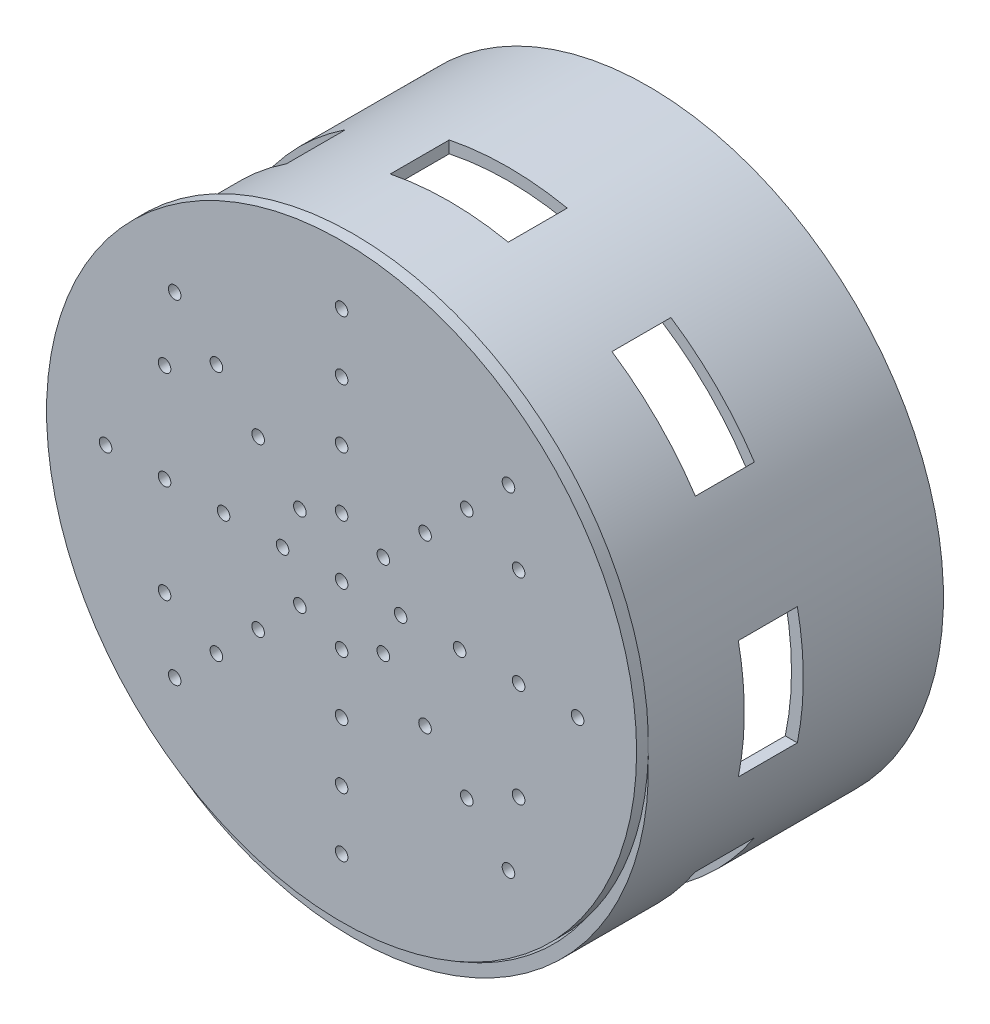
from build123d import *

# Parameters (mm, degrees)
SKETCH1_R                    = 75
SKETCH1_R_2                  = 1.6
BOSS_EXTRUDE1_DEPTH          = 3
SKETCH2_R                    = 75
SKETCH2_R_2                  = 72
BOSS_EXTRUDE2_DEPTH          = 75
SKETCH3_W                    = 30
SKETCH3_H                    = 15
CUT_EXTRUDE1_DEPTH           = 14
CIRPATTERN1_COUNT            = 8
SKETCH4_R                    = 1.6
CUT_EXTRUDE2_DEPTH           = 3
LPATTERN2_COUNT              = 5
LPATTERN2_PITCH              = 15
CIRPATTERN2_COPY_1_SKETCH_R  = 1.6
CIRPATTERN2_COPY_1_DEPTH     = 3
CIRPATTERN2_COPY_2_SKETCH_R  = 1.6
CIRPATTERN2_COPY_2_DEPTH     = 3
CIRPATTERN2_COPY_3_SKETCH_R  = 1.6
CIRPATTERN2_COPY_3_DEPTH     = 3
CIRPATTERN2_COPY_4_SKETCH_R  = 1.6
CIRPATTERN2_COPY_4_DEPTH     = 3
CIRPATTERN2_COPY_5_SKETCH_R  = 1.6
CIRPATTERN2_COPY_5_DEPTH     = 3
CIRPATTERN2_COPY_6_SKETCH_R  = 1.6
CIRPATTERN2_COPY_6_DEPTH     = 3
CIRPATTERN2_COPY_7_SKETCH_R  = 1.6
CIRPATTERN2_COPY_7_DEPTH     = 3
CIRPATTERN2_COPY_8_SKETCH_R  = 1.6
CIRPATTERN2_COPY_8_DEPTH     = 3
CIRPATTERN2_COPY_9_SKETCH_R  = 1.6
CIRPATTERN2_COPY_9_DEPTH     = 3
CIRPATTERN2_COPY_10_SKETCH_R = 1.6
CIRPATTERN2_COPY_10_DEPTH    = 3
CIRPATTERN2_COPY_11_SKETCH_R = 1.6
CIRPATTERN2_COPY_11_DEPTH    = 3
CIRPATTERN2_COPY_12_SKETCH_R = 1.6
CIRPATTERN2_COPY_12_DEPTH    = 3
CIRPATTERN2_COPY_13_SKETCH_R = 1.6
CIRPATTERN2_COPY_13_DEPTH    = 3
CIRPATTERN2_COPY_14_SKETCH_R = 1.6
CIRPATTERN2_COPY_14_DEPTH    = 3
CIRPATTERN2_COPY_15_SKETCH_R = 1.6
CIRPATTERN2_COPY_15_DEPTH    = 3
CIRPATTERN2_COPY_16_SKETCH_R = 1.6
CIRPATTERN2_COPY_16_DEPTH    = 3
CIRPATTERN2_COPY_17_SKETCH_R = 1.6
CIRPATTERN2_COPY_17_DEPTH    = 3
CIRPATTERN2_COPY_18_SKETCH_R = 1.6
CIRPATTERN2_COPY_18_DEPTH    = 3
CIRPATTERN2_COPY_19_SKETCH_R = 1.6
CIRPATTERN2_COPY_19_DEPTH    = 3
CIRPATTERN2_COPY_20_SKETCH_R = 1.6
CIRPATTERN2_COPY_20_DEPTH    = 3
CIRPATTERN2_COPY_21_SKETCH_R = 1.6
CIRPATTERN2_COPY_21_DEPTH    = 3
CIRPATTERN2_COPY_22_SKETCH_R = 1.6
CIRPATTERN2_COPY_22_DEPTH    = 3
CIRPATTERN2_COPY_23_SKETCH_R = 1.6
CIRPATTERN2_COPY_23_DEPTH    = 3
CIRPATTERN2_COPY_24_SKETCH_R = 1.6
CIRPATTERN2_COPY_24_DEPTH    = 3
CIRPATTERN2_COPY_25_SKETCH_R = 1.6
CIRPATTERN2_COPY_25_DEPTH    = 3
CIRPATTERN2_COPY_26_SKETCH_R = 1.6
CIRPATTERN2_COPY_26_DEPTH    = 3
CIRPATTERN2_COPY_27_SKETCH_R = 1.6
CIRPATTERN2_COPY_27_DEPTH    = 3
CIRPATTERN2_COPY_28_SKETCH_R = 1.6
CIRPATTERN2_COPY_28_DEPTH    = 3
CIRPATTERN2_COPY_29_SKETCH_R = 1.6
CIRPATTERN2_COPY_29_DEPTH    = 3
CIRPATTERN2_COPY_30_SKETCH_R = 1.6
CIRPATTERN2_COPY_30_DEPTH    = 3
CIRPATTERN2_COPY_31_SKETCH_R = 1.6
CIRPATTERN2_COPY_31_DEPTH    = 3
CIRPATTERN2_COPY_32_SKETCH_R = 1.6
CIRPATTERN2_COPY_32_DEPTH    = 3
CIRPATTERN2_COPY_33_SKETCH_R = 1.6
CIRPATTERN2_COPY_33_DEPTH    = 3
CIRPATTERN2_COPY_34_SKETCH_R = 1.6
CIRPATTERN2_COPY_34_DEPTH    = 3
CIRPATTERN2_COPY_35_SKETCH_R = 1.6
CIRPATTERN2_COPY_35_DEPTH    = 3


with BuildPart() as part:
    # Sketch1 → Boss-Extrude1 (new body)
    with BuildSketch(Plane.XY):
        with Locations((56.033557165, -98.835370465)):
            Circle(SKETCH1_R)
        with Locations((11.033557165, -73.835370465)):
            Circle(SKETCH1_R_2, mode=Mode.SUBTRACT)
        with Locations((101.033557165, -73.835370465)):
            Circle(SKETCH1_R_2, mode=Mode.SUBTRACT)
        with Locations((11.033557165, -123.835370465)):
            Circle(SKETCH1_R_2, mode=Mode.SUBTRACT)
        with Locations((101.033557165, -123.835370465)):
            Circle(SKETCH1_R_2, mode=Mode.SUBTRACT)
    extrude(amount=BOSS_EXTRUDE1_DEPTH)

    # Sketch2 → Boss-Extrude2 (add)
    with BuildSketch(Plane(origin=(0, 0, 0), x_dir=(-1, 0, 0), z_dir=(0, 0, -1))):
        with Locations(Location((-56.033557165, -103.835370465, 0), (0, 0, 178.089786828))):
            Circle(SKETCH2_R)
        with Locations(Location((-56.033557165, -103.835370465, 0), (0, 0, 215.294394677))):
            Circle(SKETCH2_R_2, mode=Mode.SUBTRACT)
    extrude(amount=BOSS_EXTRUDE2_DEPTH)

    # Sketch3 → Cut-Extrude1 (cut)
    with BuildSketch(Plane(origin=(0, -23.835370465, 0), x_dir=(1, 0, 0), z_dir=(0, 1, 0))):
        with Locations((56.033557165, 31.87)):
            Rectangle(SKETCH3_W, SKETCH3_H)
    cut_extrude1 = extrude(amount=-CUT_EXTRUDE1_DEPTH, mode=Mode.SUBTRACT)

    # CirPattern1: Cut-Extrude1 ×8 about axis
    cirpattern1_axis = Axis((56.033557165, -103.835370465, 0), (0, 0, 1))
    for i in range(1, CIRPATTERN1_COUNT):
        add(cut_extrude1.rotate(cirpattern1_axis, i * 360 / CIRPATTERN1_COUNT), mode=Mode.SUBTRACT)

    # Sketch4 → Cut-Extrude2 (cut)
    with BuildSketch(Plane.XY.offset(3)):
        with Locations((56.033557165, -98.835370465)):
            Circle(SKETCH4_R)
    cut_extrude2 = extrude(amount=-CUT_EXTRUDE2_DEPTH, mode=Mode.SUBTRACT)

    # LPattern2: Cut-Extrude2 ×5
    with Locations(*[(0, i * LPATTERN2_PITCH, 0) for i in range(1, LPATTERN2_COUNT)]):
        add(cut_extrude2, mode=Mode.SUBTRACT)

    # CirPattern2 copy 1 sketch → CirPattern2 copy 1 (cut)
    with BuildSketch(Plane(origin=(-64.081913475, -57.963316316, 3), x_dir=(0.7071067811865476, 0.7071067811865475, 0), z_dir=(0, 0, 1))):
        with Locations((56.033557165, -98.835370465)):
            Circle(CIRPATTERN2_COPY_1_SKETCH_R)
    extrude(amount=-CIRPATTERN2_COPY_1_DEPTH, mode=Mode.SUBTRACT)

    # CirPattern2 copy 2 sketch → CirPattern2 copy 2 (cut)
    with BuildSketch(Plane(origin=(-57.8018133, -154.86892763, 3), x_dir=(0, 1, 0), z_dir=(0, 0, 1))):
        with Locations((56.033557165, -98.835370465)):
            Circle(CIRPATTERN2_COPY_2_SKETCH_R)
    extrude(amount=-CIRPATTERN2_COPY_2_DEPTH, mode=Mode.SUBTRACT)

    # CirPattern2 copy 3 sketch → CirPattern2 copy 3 (cut)
    with BuildSketch(Plane(origin=(15.161503016, -218.950841105, 3), x_dir=(-0.7071067811865475, 0.7071067811865476, 0), z_dir=(0, 0, 1))):
        with Locations((56.033557165, -98.835370465)):
            Circle(CIRPATTERN2_COPY_3_SKETCH_R)
    extrude(amount=-CIRPATTERN2_COPY_3_DEPTH, mode=Mode.SUBTRACT)

    # CirPattern2 copy 4 sketch → CirPattern2 copy 4 (cut)
    with BuildSketch(Plane(origin=(112.06711433, -212.670740929, 3), x_dir=(-1, 0, 0), z_dir=(0, 0, 1))):
        with Locations((56.033557165, -98.835370465)):
            Circle(CIRPATTERN2_COPY_4_SKETCH_R)
    extrude(amount=-CIRPATTERN2_COPY_4_DEPTH, mode=Mode.SUBTRACT)

    # CirPattern2 copy 5 sketch → CirPattern2 copy 5 (cut)
    with BuildSketch(Plane(origin=(176.149027805, -139.707424614, 3), x_dir=(-0.7071067811865477, -0.7071067811865475, 0), z_dir=(0, 0, 1))):
        with Locations((56.033557165, -98.835370465)):
            Circle(CIRPATTERN2_COPY_5_SKETCH_R)
    extrude(amount=-CIRPATTERN2_COPY_5_DEPTH, mode=Mode.SUBTRACT)

    # CirPattern2 copy 6 sketch → CirPattern2 copy 6 (cut)
    with BuildSketch(Plane(origin=(169.86892763, -42.8018133, 3), x_dir=(0, -1, 0), z_dir=(0, 0, 1))):
        with Locations((56.033557165, -98.835370465)):
            Circle(CIRPATTERN2_COPY_6_SKETCH_R)
    extrude(amount=-CIRPATTERN2_COPY_6_DEPTH, mode=Mode.SUBTRACT)

    # CirPattern2 copy 7 sketch → CirPattern2 copy 7 (cut)
    with BuildSketch(Plane(origin=(96.905611314, 21.280100175, 3), x_dir=(0.7071067811865474, -0.7071067811865477, 0), z_dir=(0, 0, 1))):
        with Locations((56.033557165, -98.835370465)):
            Circle(CIRPATTERN2_COPY_7_SKETCH_R)
    extrude(amount=-CIRPATTERN2_COPY_7_DEPTH, mode=Mode.SUBTRACT)

    # CirPattern2 copy 8 sketch → CirPattern2 copy 8 (cut)
    with BuildSketch(Plane(origin=(-74.688515193, -47.356714598, 3), x_dir=(0.7071067811865476, 0.7071067811865475, 0), z_dir=(0, 0, 1))):
        with Locations((56.033557165, -98.835370465)):
            Circle(CIRPATTERN2_COPY_8_SKETCH_R)
    extrude(amount=-CIRPATTERN2_COPY_8_DEPTH, mode=Mode.SUBTRACT)

    # CirPattern2 copy 9 sketch → CirPattern2 copy 9 (cut)
    with BuildSketch(Plane(origin=(-72.8018133, -154.86892763, 3), x_dir=(0, 1, 0), z_dir=(0, 0, 1))):
        with Locations((56.033557165, -98.835370465)):
            Circle(CIRPATTERN2_COPY_9_SKETCH_R)
    extrude(amount=-CIRPATTERN2_COPY_9_DEPTH, mode=Mode.SUBTRACT)

    # CirPattern2 copy 10 sketch → CirPattern2 copy 10 (cut)
    with BuildSketch(Plane(origin=(4.554901298, -229.557442822, 3), x_dir=(-0.7071067811865475, 0.7071067811865476, 0), z_dir=(0, 0, 1))):
        with Locations((56.033557165, -98.835370465)):
            Circle(CIRPATTERN2_COPY_10_SKETCH_R)
    extrude(amount=-CIRPATTERN2_COPY_10_DEPTH, mode=Mode.SUBTRACT)

    # CirPattern2 copy 11 sketch → CirPattern2 copy 11 (cut)
    with BuildSketch(Plane(origin=(112.06711433, -227.670740929, 3), x_dir=(-1, 0, 0), z_dir=(0, 0, 1))):
        with Locations((56.033557165, -98.835370465)):
            Circle(CIRPATTERN2_COPY_11_SKETCH_R)
    extrude(amount=-CIRPATTERN2_COPY_11_DEPTH, mode=Mode.SUBTRACT)

    # CirPattern2 copy 12 sketch → CirPattern2 copy 12 (cut)
    with BuildSketch(Plane(origin=(186.755629523, -150.314026332, 3), x_dir=(-0.7071067811865477, -0.7071067811865475, 0), z_dir=(0, 0, 1))):
        with Locations((56.033557165, -98.835370465)):
            Circle(CIRPATTERN2_COPY_12_SKETCH_R)
    extrude(amount=-CIRPATTERN2_COPY_12_DEPTH, mode=Mode.SUBTRACT)

    # CirPattern2 copy 13 sketch → CirPattern2 copy 13 (cut)
    with BuildSketch(Plane(origin=(184.86892763, -42.8018133, 3), x_dir=(0, -1, 0), z_dir=(0, 0, 1))):
        with Locations((56.033557165, -98.835370465)):
            Circle(CIRPATTERN2_COPY_13_SKETCH_R)
    extrude(amount=-CIRPATTERN2_COPY_13_DEPTH, mode=Mode.SUBTRACT)

    # CirPattern2 copy 14 sketch → CirPattern2 copy 14 (cut)
    with BuildSketch(Plane(origin=(107.512213032, 31.886701893, 3), x_dir=(0.7071067811865474, -0.7071067811865477, 0), z_dir=(0, 0, 1))):
        with Locations((56.033557165, -98.835370465)):
            Circle(CIRPATTERN2_COPY_14_SKETCH_R)
    extrude(amount=-CIRPATTERN2_COPY_14_DEPTH, mode=Mode.SUBTRACT)

    # CirPattern2 copy 15 sketch → CirPattern2 copy 15 (cut)
    with BuildSketch(Plane(origin=(-85.29511691, -36.75011288, 3), x_dir=(0.7071067811865476, 0.7071067811865475, 0), z_dir=(0, 0, 1))):
        with Locations((56.033557165, -98.835370465)):
            Circle(CIRPATTERN2_COPY_15_SKETCH_R)
    extrude(amount=-CIRPATTERN2_COPY_15_DEPTH, mode=Mode.SUBTRACT)

    # CirPattern2 copy 16 sketch → CirPattern2 copy 16 (cut)
    with BuildSketch(Plane(origin=(-87.8018133, -154.86892763, 3), x_dir=(0, 1, 0), z_dir=(0, 0, 1))):
        with Locations((56.033557165, -98.835370465)):
            Circle(CIRPATTERN2_COPY_16_SKETCH_R)
    extrude(amount=-CIRPATTERN2_COPY_16_DEPTH, mode=Mode.SUBTRACT)

    # CirPattern2 copy 17 sketch → CirPattern2 copy 17 (cut)
    with BuildSketch(Plane(origin=(-6.05170042, -240.16404454, 3), x_dir=(-0.7071067811865475, 0.7071067811865476, 0), z_dir=(0, 0, 1))):
        with Locations((56.033557165, -98.835370465)):
            Circle(CIRPATTERN2_COPY_17_SKETCH_R)
    extrude(amount=-CIRPATTERN2_COPY_17_DEPTH, mode=Mode.SUBTRACT)

    # CirPattern2 copy 18 sketch → CirPattern2 copy 18 (cut)
    with BuildSketch(Plane(origin=(112.06711433, -242.670740929, 3), x_dir=(-1, 0, 0), z_dir=(0, 0, 1))):
        with Locations((56.033557165, -98.835370465)):
            Circle(CIRPATTERN2_COPY_18_SKETCH_R)
    extrude(amount=-CIRPATTERN2_COPY_18_DEPTH, mode=Mode.SUBTRACT)

    # CirPattern2 copy 19 sketch → CirPattern2 copy 19 (cut)
    with BuildSketch(Plane(origin=(197.36223124, -160.920628049, 3), x_dir=(-0.7071067811865477, -0.7071067811865475, 0), z_dir=(0, 0, 1))):
        with Locations((56.033557165, -98.835370465)):
            Circle(CIRPATTERN2_COPY_19_SKETCH_R)
    extrude(amount=-CIRPATTERN2_COPY_19_DEPTH, mode=Mode.SUBTRACT)

    # CirPattern2 copy 20 sketch → CirPattern2 copy 20 (cut)
    with BuildSketch(Plane(origin=(199.86892763, -42.8018133, 3), x_dir=(0, -1, 0), z_dir=(0, 0, 1))):
        with Locations((56.033557165, -98.835370465)):
            Circle(CIRPATTERN2_COPY_20_SKETCH_R)
    extrude(amount=-CIRPATTERN2_COPY_20_DEPTH, mode=Mode.SUBTRACT)

    # CirPattern2 copy 21 sketch → CirPattern2 copy 21 (cut)
    with BuildSketch(Plane(origin=(118.11881475, 42.493303611, 3), x_dir=(0.7071067811865474, -0.7071067811865477, 0), z_dir=(0, 0, 1))):
        with Locations((56.033557165, -98.835370465)):
            Circle(CIRPATTERN2_COPY_21_SKETCH_R)
    extrude(amount=-CIRPATTERN2_COPY_21_DEPTH, mode=Mode.SUBTRACT)

    # CirPattern2 copy 22 sketch → CirPattern2 copy 22 (cut)
    with BuildSketch(Plane(origin=(-95.901718628, -26.143511162, 3), x_dir=(0.7071067811865476, 0.7071067811865475, 0), z_dir=(0, 0, 1))):
        with Locations((56.033557165, -98.835370465)):
            Circle(CIRPATTERN2_COPY_22_SKETCH_R)
    extrude(amount=-CIRPATTERN2_COPY_22_DEPTH, mode=Mode.SUBTRACT)

    # CirPattern2 copy 23 sketch → CirPattern2 copy 23 (cut)
    with BuildSketch(Plane(origin=(-102.8018133, -154.86892763, 3), x_dir=(0, 1, 0), z_dir=(0, 0, 1))):
        with Locations((56.033557165, -98.835370465)):
            Circle(CIRPATTERN2_COPY_23_SKETCH_R)
    extrude(amount=-CIRPATTERN2_COPY_23_DEPTH, mode=Mode.SUBTRACT)

    # CirPattern2 copy 24 sketch → CirPattern2 copy 24 (cut)
    with BuildSketch(Plane(origin=(-16.658302138, -250.770646258, 3), x_dir=(-0.7071067811865475, 0.7071067811865476, 0), z_dir=(0, 0, 1))):
        with Locations((56.033557165, -98.835370465)):
            Circle(CIRPATTERN2_COPY_24_SKETCH_R)
    extrude(amount=-CIRPATTERN2_COPY_24_DEPTH, mode=Mode.SUBTRACT)

    # CirPattern2 copy 25 sketch → CirPattern2 copy 25 (cut)
    with BuildSketch(Plane(origin=(112.06711433, -257.670740929, 3), x_dir=(-1, 0, 0), z_dir=(0, 0, 1))):
        with Locations((56.033557165, -98.835370465)):
            Circle(CIRPATTERN2_COPY_25_SKETCH_R)
    extrude(amount=-CIRPATTERN2_COPY_25_DEPTH, mode=Mode.SUBTRACT)

    # CirPattern2 copy 26 sketch → CirPattern2 copy 26 (cut)
    with BuildSketch(Plane(origin=(207.968832958, -171.527229767, 3), x_dir=(-0.7071067811865477, -0.7071067811865475, 0), z_dir=(0, 0, 1))):
        with Locations((56.033557165, -98.835370465)):
            Circle(CIRPATTERN2_COPY_26_SKETCH_R)
    extrude(amount=-CIRPATTERN2_COPY_26_DEPTH, mode=Mode.SUBTRACT)

    # CirPattern2 copy 27 sketch → CirPattern2 copy 27 (cut)
    with BuildSketch(Plane(origin=(214.86892763, -42.8018133, 3), x_dir=(0, -1, 0), z_dir=(0, 0, 1))):
        with Locations((56.033557165, -98.835370465)):
            Circle(CIRPATTERN2_COPY_27_SKETCH_R)
    extrude(amount=-CIRPATTERN2_COPY_27_DEPTH, mode=Mode.SUBTRACT)

    # CirPattern2 copy 28 sketch → CirPattern2 copy 28 (cut)
    with BuildSketch(Plane(origin=(128.725416467, 53.099905329, 3), x_dir=(0.7071067811865474, -0.7071067811865477, 0), z_dir=(0, 0, 1))):
        with Locations((56.033557165, -98.835370465)):
            Circle(CIRPATTERN2_COPY_28_SKETCH_R)
    extrude(amount=-CIRPATTERN2_COPY_28_DEPTH, mode=Mode.SUBTRACT)

    # CirPattern2 copy 29 sketch → CirPattern2 copy 29 (cut)
    with BuildSketch(Plane(origin=(-53.475311757, -68.569918033, 3), x_dir=(0.7071067811865476, 0.7071067811865475, 0), z_dir=(0, 0, 1))):
        with Locations((56.033557165, -98.835370465)):
            Circle(CIRPATTERN2_COPY_29_SKETCH_R)
    extrude(amount=-CIRPATTERN2_COPY_29_DEPTH, mode=Mode.SUBTRACT)

    # CirPattern2 copy 30 sketch → CirPattern2 copy 30 (cut)
    with BuildSketch(Plane(origin=(-42.8018133, -154.86892763, 3), x_dir=(0, 1, 0), z_dir=(0, 0, 1))):
        with Locations((56.033557165, -98.835370465)):
            Circle(CIRPATTERN2_COPY_30_SKETCH_R)
    extrude(amount=-CIRPATTERN2_COPY_30_DEPTH, mode=Mode.SUBTRACT)

    # CirPattern2 copy 31 sketch → CirPattern2 copy 31 (cut)
    with BuildSketch(Plane(origin=(25.768104734, -208.344239387, 3), x_dir=(-0.7071067811865475, 0.7071067811865476, 0), z_dir=(0, 0, 1))):
        with Locations((56.033557165, -98.835370465)):
            Circle(CIRPATTERN2_COPY_31_SKETCH_R)
    extrude(amount=-CIRPATTERN2_COPY_31_DEPTH, mode=Mode.SUBTRACT)

    # CirPattern2 copy 32 sketch → CirPattern2 copy 32 (cut)
    with BuildSketch(Plane(origin=(112.06711433, -197.670740929, 3), x_dir=(-1, 0, 0), z_dir=(0, 0, 1))):
        with Locations((56.033557165, -98.835370465)):
            Circle(CIRPATTERN2_COPY_32_SKETCH_R)
    extrude(amount=-CIRPATTERN2_COPY_32_DEPTH, mode=Mode.SUBTRACT)

    # CirPattern2 copy 33 sketch → CirPattern2 copy 33 (cut)
    with BuildSketch(Plane(origin=(165.542426087, -129.100822896, 3), x_dir=(-0.7071067811865477, -0.7071067811865475, 0), z_dir=(0, 0, 1))):
        with Locations((56.033557165, -98.835370465)):
            Circle(CIRPATTERN2_COPY_33_SKETCH_R)
    extrude(amount=-CIRPATTERN2_COPY_33_DEPTH, mode=Mode.SUBTRACT)

    # CirPattern2 copy 34 sketch → CirPattern2 copy 34 (cut)
    with BuildSketch(Plane(origin=(154.86892763, -42.8018133, 3), x_dir=(0, -1, 0), z_dir=(0, 0, 1))):
        with Locations((56.033557165, -98.835370465)):
            Circle(CIRPATTERN2_COPY_34_SKETCH_R)
    extrude(amount=-CIRPATTERN2_COPY_34_DEPTH, mode=Mode.SUBTRACT)

    # CirPattern2 copy 35 sketch → CirPattern2 copy 35 (cut)
    with BuildSketch(Plane(origin=(86.299009596, 10.673498457, 3), x_dir=(0.7071067811865474, -0.7071067811865477, 0), z_dir=(0, 0, 1))):
        with Locations((56.033557165, -98.835370465)):
            Circle(CIRPATTERN2_COPY_35_SKETCH_R)
    extrude(amount=-CIRPATTERN2_COPY_35_DEPTH, mode=Mode.SUBTRACT)


solid = part.part
